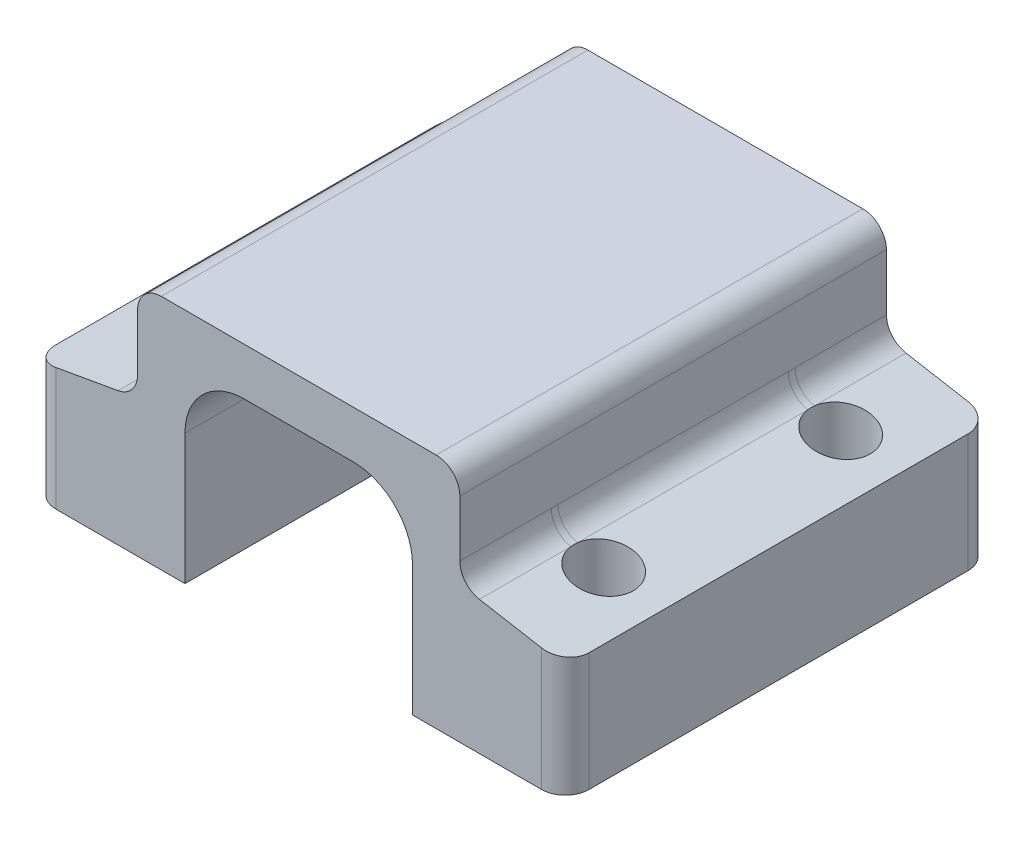
from build123d import *

# Parameters (mm, degrees)
BOSS_EXTRUDE1_DEPTH = 22.86
BOSS_EXTRUDE2_DEPTH = 13.462
BOSS_EXTRUDE3_START = -1.27
BOSS_EXTRUDE3_DEPTH = 1.905
BOSS_EXTRUDE4_START = -1.27
BOSS_EXTRUDE4_DEPTH = 3.81
FILLET1_R           = 1.27


with BuildPart() as part:
    # Sketch1 → Boss-Extrude1 (new body)
    with BuildSketch(Plane.XY):
        Polygon((-6.096, 10.16), (6.096, 10.16), (6.096, 0), (14.2875, 0), (14.2875, 6.35), (8.636, 7.346511931), (8.636, 12.7), (-8.636, 12.7), (-8.636, 7.346511931), (-14.2875, 6.35), (-14.2875, 0), (-6.096, 0), align=None)
    extrude(amount=-BOSS_EXTRUDE1_DEPTH)

    # Sketch2 → Boss-Extrude2 (add)
    with BuildSketch(Plane.XY):
        with BuildLine():
            Line((2.921, 10.16), (6.096, 10.16))
            Line((6.096, 10.16), (6.096, 6.985))
            ThreePointArc((6.096, 6.985), (5.16606403, 9.23006403), (2.921, 10.16))
        make_face()
        with BuildLine():
            Line((-6.096, 10.16), (-6.096, 6.985))
            ThreePointArc((-6.096, 6.985), (-5.16606403, 9.23006403), (-2.921, 10.16))
            Line((-2.921, 10.16), (-6.096, 10.16))
        make_face()
    extrude(amount=-BOSS_EXTRUDE2_DEPTH)

    # Sketch3 → Boss-Extrude3 (add)
    with BuildSketch(Plane.XY.offset(-13.462).offset(BOSS_EXTRUDE3_START)):
        with BuildLine():
            Line((-6.096, 10.16), (-6.096, 6.985))
            ThreePointArc((-6.096, 6.985), (-5.16606403, 9.23006403), (-2.921, 10.16))
            Line((-2.921, 10.16), (-6.096, 10.16))
        make_face()
    extrude(amount=-BOSS_EXTRUDE3_DEPTH)

    # Sketch4 → Boss-Extrude4 (add)
    with BuildSketch(Plane.XY.offset(-16.637).offset(BOSS_EXTRUDE4_START)):
        with BuildLine():
            Line((-6.096, 10.16), (-6.096, 6.985))
            ThreePointArc((-6.096, 6.985), (-5.16606403, 9.23006403), (-2.921, 10.16))
            Line((-2.921, 10.16), (-6.096, 10.16))
        make_face()
    extrude(amount=-BOSS_EXTRUDE4_DEPTH)

    # Sketch6 → Cut-Revolve1 (revolve, cut)
    with BuildSketch(Plane.XY.offset(-5.08), mode=Mode.PRIVATE) as cut_revolve1_sk:
        Polygon((11.262482277, -1.27), (12.849982277, -1.27), (12.849982277, 6.60347316), (12.849982277, 9.423392242), (11.262482277, 9.423392242), (11.262482277, 6.883392242), align=None)
    cut_revolve1 = revolve(cut_revolve1_sk.sketch.rotate(Axis((11.262482277, -1.27, -5.08), (0, -1, 0)), 180), axis=Axis((11.262482277, -1.27, -5.08), (0, -1, 0)), mode=Mode.SUBTRACT)

    # Mirror1: Cut-Revolve1 across plane
    add(cut_revolve1.mirror(Plane(origin=(0, 0, 0), x_dir=(0, 0, 1), z_dir=(1, 0, 0))), mode=Mode.SUBTRACT)

    # Mirror2: Cut-Revolve1 across plane
    add(cut_revolve1.mirror(Plane.XY.offset(-11.43)), mode=Mode.SUBTRACT)

    # Mirror2 copy 1 sketch → Mirror2 copy 1 (revolve, cut)
    with BuildSketch(Plane(origin=(0, 0, -17.78), x_dir=(-1, 0, 0), z_dir=(0, 0, -1))):
        Polygon((11.262482277, -1.27), (12.849982277, -1.27), (12.849982277, 6.60347316), (12.849982277, 9.423392242), (11.262482277, 9.423392242), (11.262482277, 6.883392242), align=None)
    revolve(axis=Axis((-11.262482277, -1.27, -17.78), (0, -1, 0)), mode=Mode.SUBTRACT)

    # Fillet1
    fillet1_edges = [part.edges().sort_by_distance(p)[0] for p in [
        (-14.2875, 3.175, 0),
        (14.2875, 3.175, 0),
        (14.2875, 3.175, -22.86),
        (-8.636, 7.346511931, -11.43),
        (-8.636, 12.7, -11.43),
        (8.636, 12.7, -11.43),
        (8.636, 7.346511931, -11.43),
        (-14.2875, 3.175, -22.86),
    ]]
    fillet(fillet1_edges, radius=FILLET1_R)


solid = part.part
